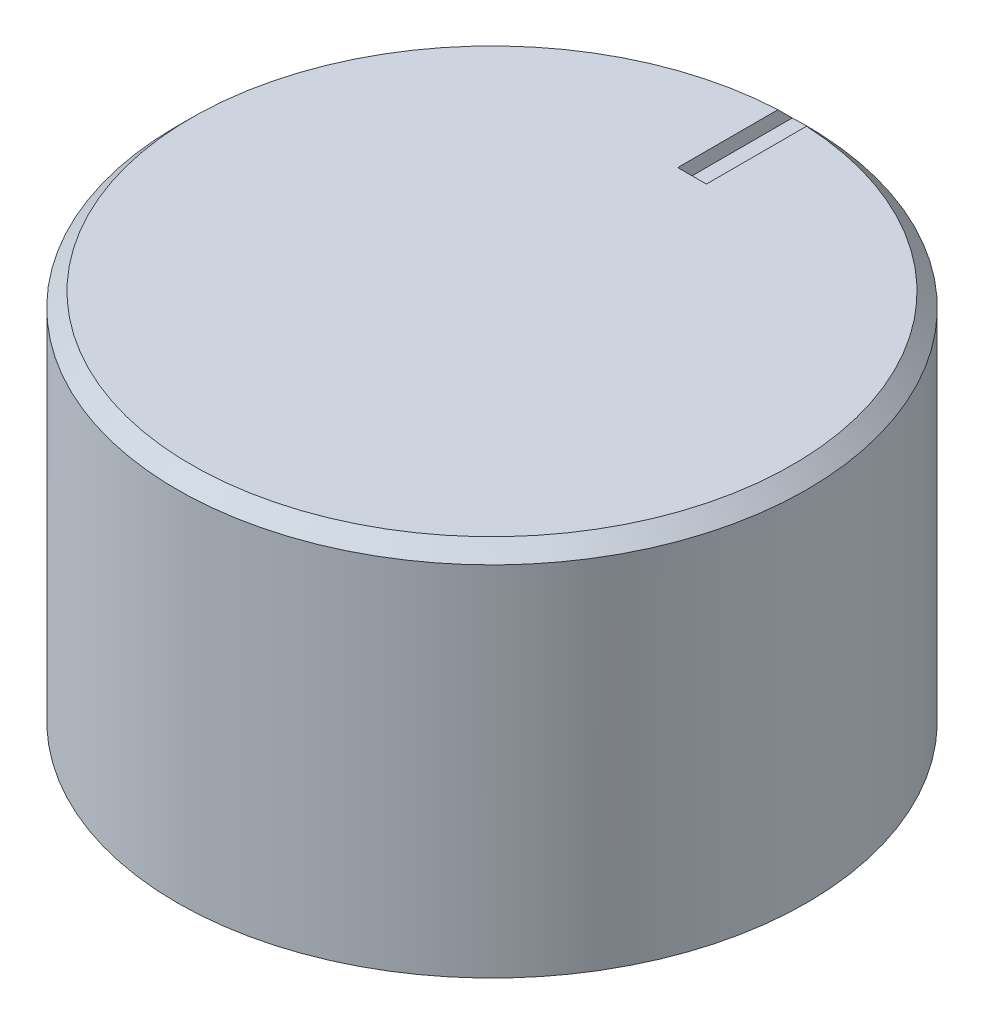
from build123d import *

# Parameters (mm, degrees)
SKETCH1_R               = 11
BOSS_EXTRUDE1_DEPTH     = 13
HOLE1_D                 = 6.35
HOLE1_DEPTH             = 10
CUT_EXTRUDE2_DEPTH      = 21.273134933
CUT_EXTRUDE2_DEPTH_BACK = 0.5
CHAMFER1_SIZE           = 0.5


with BuildPart() as part:
    # Sketch1 → Boss-Extrude1 (new body)
    with BuildSketch(Plane(origin=(0, 0, 0), x_dir=(1, 0, 0), z_dir=(0, 1, 0))):
        with Locations(Location((0, 0, 0), (0, 0, 90))):
            Circle(SKETCH1_R)
    extrude(amount=BOSS_EXTRUDE1_DEPTH)

    # Hole1
    with Locations(Plane(origin=(0, 0, 0), x_dir=(-1, 0, 0), z_dir=(0, -1, 0))):
        with Locations((0, 0)):
            Hole(HOLE1_D / 2, depth=HOLE1_DEPTH)

    # Sketch5 → Cut-Extrude2 (cut, two sides: drawn at the far end of the back side and taken through both)
    with BuildSketch(Plane(origin=(0, 13, 0), x_dir=(1, 0, 0), z_dir=(0, 1, 0)).offset(-CUT_EXTRUDE2_DEPTH_BACK)):
        Polygon((0.5, 70.617246053), (0.5, 10.988630488), (0.5, 6.988630488), (-0.5, 6.988630488), (-0.5, 10.988630488), (-0.5, 70.617246053), (-0.5, 189.874477184), (0.5, 189.874477184), align=None)
    extrude(amount=CUT_EXTRUDE2_DEPTH + CUT_EXTRUDE2_DEPTH_BACK, mode=Mode.SUBTRACT)

    # Chamfer1
    chamfer1_edges = [part.edges().sort_by_distance(p)[0] for p in [
        (0, 13, 11),
    ]]
    chamfer(chamfer1_edges, length=CHAMFER1_SIZE)


solid = part.part
